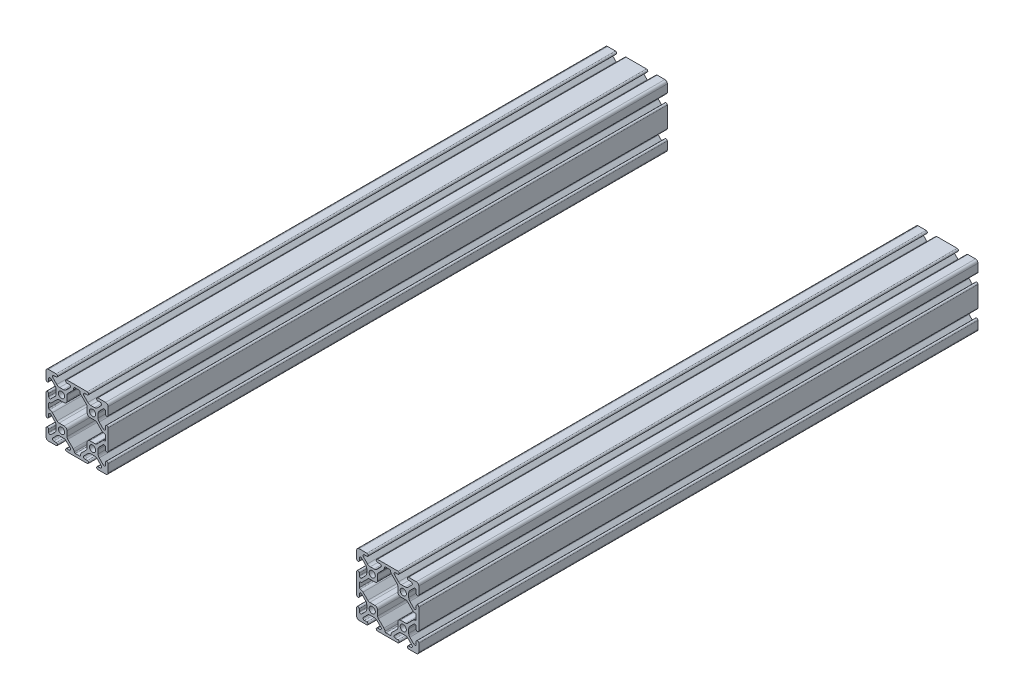
from build123d import *

# Parameters (mm, degrees)
SKETCH1_R                                = 2.5
F_25_SERIES_EXTRUSIONS_25_5050_1_DEPTH   = 450
SKETCH1_ON_SEGMENT_2_R                   = 2.5
F_25_SERIES_EXTRUSIONS_25_5050_1_2_DEPTH = 450


with BuildPart() as part:
    # Sketch1 → 25 series extrusions 25-5050(1) (new body)
    with BuildSketch(Plane(origin=(-125, 0, 0), x_dir=(0, 1, 0), z_dir=(0, 0, 1))):
        with BuildLine():
            Line((16.815, -25), (23, -25))
            ThreePointArc((23, -25), (24.414213562, -24.414213562), (25, -23))
            Line((25, -23), (25, -16.815))
            ThreePointArc((25, -16.815), (23.935, -15.75), (22.87, -16.815))
            Line((22.87, -16.815), (22.87, -18.772801987))
            ThreePointArc((22.87, -18.772801987), (22.208114403, -19.763383786), (21.039643501, -19.530960473))
            Line((21.039643501, -19.530960473), (17.811043881, -16.302360852))
            ThreePointArc((17.811043881, -16.302360852), (17.122790395, -15.27231672), (16.881107911, -14.057296822))
            Line((16.881107911, -14.057296822), (16.881107911, -10.942703178))
            ThreePointArc((16.881107911, -10.942703178), (17.122790395, -9.72768328), (17.811043881, -8.697639148))
            Line((17.811043881, -8.697639148), (21.039643501, -5.469039527))
            ThreePointArc((21.039643501, -5.469039527), (22.208114403, -5.236616214), (22.87, -6.227198013))
            Line((22.87, -6.227198013), (22.87, -8.185))
            ThreePointArc((22.87, -8.185), (23.935, -9.25), (25, -8.185))
            Line((25, -8.185), (25, 8.185))
            ThreePointArc((25, 8.185), (23.935, 9.25), (22.87, 8.185))
            Line((22.87, 8.185), (22.87, 6.227198013))
            ThreePointArc((22.87, 6.227198013), (22.208114403, 5.236616214), (21.039643501, 5.469039527))
            Line((21.039643501, 5.469039527), (17.811043881, 8.697639148))
            ThreePointArc((17.811043881, 8.697639148), (17.122790395, 9.72768328), (16.881107911, 10.942703178))
            Line((16.881107911, 10.942703178), (16.881107911, 14.057296822))
            ThreePointArc((16.881107911, 14.057296822), (17.122790395, 15.27231672), (17.811043881, 16.302360852))
            Line((17.811043881, 16.302360852), (21.039643501, 19.530960473))
            ThreePointArc((21.039643501, 19.530960473), (22.208114403, 19.763383786), (22.87, 18.772801987))
            Line((22.87, 18.772801987), (22.87, 16.815))
            ThreePointArc((22.87, 16.815), (23.935, 15.75), (25, 16.815))
            Line((25, 16.815), (25, 23))
            ThreePointArc((25, 23), (24.414213562, 24.414213562), (23, 25))
            Line((23, 25), (16.815, 25))
            ThreePointArc((16.815, 25), (15.75, 23.935), (16.815, 22.87))
            Line((16.815, 22.87), (18.772801987, 22.87))
            ThreePointArc((18.772801987, 22.87), (19.763383786, 22.208114403), (19.530960473, 21.039643501))
            Line((19.530960473, 21.039643501), (16.302360852, 17.811043881))
            ThreePointArc((16.302360852, 17.811043881), (15.27231672, 17.122790395), (14.057296822, 16.881107911))
            Line((14.057296822, 16.881107911), (10.942703178, 16.881107911))
            ThreePointArc((10.942703178, 16.881107911), (9.72768328, 17.122790395), (8.697639148, 17.811043881))
            Line((8.697639148, 17.811043881), (5.469039527, 21.039643501))
            ThreePointArc((5.469039527, 21.039643501), (5.236616214, 22.208114403), (6.227198013, 22.87))
            Line((6.227198013, 22.87), (8.185, 22.87))
            ThreePointArc((8.185, 22.87), (9.25, 23.935), (8.185, 25))
            Line((8.185, 25), (-8.185, 25))
            ThreePointArc((-8.185, 25), (-9.25, 23.935), (-8.185, 22.87))
            Line((-8.185, 22.87), (-6.227198013, 22.87))
            ThreePointArc((-6.227198013, 22.87), (-5.236616214, 22.208114403), (-5.469039527, 21.039643501))
            Line((-5.469039527, 21.039643501), (-8.697639148, 17.811043881))
            ThreePointArc((-8.697639148, 17.811043881), (-9.72768328, 17.122790395), (-10.942703178, 16.881107911))
            Line((-10.942703178, 16.881107911), (-14.057296822, 16.881107911))
            ThreePointArc((-14.057296822, 16.881107911), (-15.27231672, 17.122790395), (-16.302360852, 17.811043881))
            Line((-16.302360852, 17.811043881), (-19.530960473, 21.039643501))
            ThreePointArc((-19.530960473, 21.039643501), (-19.763383786, 22.208114403), (-18.772801987, 22.87))
            Line((-18.772801987, 22.87), (-16.815, 22.87))
            ThreePointArc((-16.815, 22.87), (-15.75, 23.935), (-16.815, 25))
            Line((-16.815, 25), (-23, 25))
            ThreePointArc((-23, 25), (-24.414213562, 24.414213562), (-25, 23))
            Line((-25, 23), (-25, 16.815))
            ThreePointArc((-25, 16.815), (-23.935, 15.75), (-22.87, 16.815))
            Line((-22.87, 16.815), (-22.87, 18.772801987))
            ThreePointArc((-22.87, 18.772801987), (-22.208114403, 19.763383786), (-21.039643501, 19.530960473))
            Line((-21.039643501, 19.530960473), (-17.811043881, 16.302360852))
            ThreePointArc((-17.811043881, 16.302360852), (-17.122790395, 15.27231672), (-16.881107911, 14.057296822))
            Line((-16.881107911, 14.057296822), (-16.881107911, 10.942703178))
            ThreePointArc((-16.881107911, 10.942703178), (-17.122790395, 9.72768328), (-17.811043881, 8.697639148))
            Line((-17.811043881, 8.697639148), (-21.039643501, 5.469039527))
            ThreePointArc((-21.039643501, 5.469039527), (-22.208114403, 5.236616214), (-22.87, 6.227198013))
            Line((-22.87, 6.227198013), (-22.87, 8.185))
            ThreePointArc((-22.87, 8.185), (-23.935, 9.25), (-25, 8.185))
            Line((-25, 8.185), (-25, -8.185))
            ThreePointArc((-25, -8.185), (-23.935, -9.25), (-22.87, -8.185))
            Line((-22.87, -8.185), (-22.87, -6.227198013))
            ThreePointArc((-22.87, -6.227198013), (-22.208114403, -5.236616214), (-21.039643501, -5.469039527))
            Line((-21.039643501, -5.469039527), (-17.811043881, -8.697639148))
            ThreePointArc((-17.811043881, -8.697639148), (-17.122790395, -9.72768328), (-16.881107911, -10.942703178))
            Line((-16.881107911, -10.942703178), (-16.881107911, -14.057296822))
            ThreePointArc((-16.881107911, -14.057296822), (-17.122790395, -15.27231672), (-17.811043881, -16.302360852))
            Line((-17.811043881, -16.302360852), (-21.039643501, -19.530960473))
            ThreePointArc((-21.039643501, -19.530960473), (-22.208114403, -19.763383786), (-22.87, -18.772801987))
            Line((-22.87, -18.772801987), (-22.87, -16.815))
            ThreePointArc((-22.87, -16.815), (-23.935, -15.75), (-25, -16.815))
            Line((-25, -16.815), (-25, -23))
            ThreePointArc((-25, -23), (-24.414213562, -24.414213562), (-23, -25))
            Line((-23, -25), (-16.815, -25))
            ThreePointArc((-16.815, -25), (-15.75, -23.935), (-16.815, -22.87))
            Line((-16.815, -22.87), (-18.772801987, -22.87))
            ThreePointArc((-18.772801987, -22.87), (-19.763383786, -22.208114403), (-19.530960473, -21.039643501))
            Line((-19.530960473, -21.039643501), (-16.302360852, -17.811043881))
            ThreePointArc((-16.302360852, -17.811043881), (-15.27231672, -17.122790395), (-14.057296822, -16.881107911))
            Line((-14.057296822, -16.881107911), (-10.942703178, -16.881107911))
            ThreePointArc((-10.942703178, -16.881107911), (-9.72768328, -17.122790395), (-8.697639148, -17.811043881))
            Line((-8.697639148, -17.811043881), (-5.469039527, -21.039643501))
            ThreePointArc((-5.469039527, -21.039643501), (-5.236616214, -22.208114403), (-6.227198013, -22.87))
            Line((-6.227198013, -22.87), (-8.185, -22.87))
            ThreePointArc((-8.185, -22.87), (-9.25, -23.935), (-8.185, -25))
            Line((-8.185, -25), (8.185, -25))
            ThreePointArc((8.185, -25), (9.25, -23.935), (8.185, -22.87))
            Line((8.185, -22.87), (6.227198013, -22.87))
            ThreePointArc((6.227198013, -22.87), (5.236616214, -22.208114403), (5.469039527, -21.039643501))
            Line((5.469039527, -21.039643501), (8.697639148, -17.811043881))
            ThreePointArc((8.697639148, -17.811043881), (9.72768328, -17.122790395), (10.942703178, -16.881107911))
            Line((10.942703178, -16.881107911), (14.057296822, -16.881107911))
            ThreePointArc((14.057296822, -16.881107911), (15.27231672, -17.122790395), (16.302360852, -17.811043881))
            Line((16.302360852, -17.811043881), (19.530960473, -21.039643501))
            ThreePointArc((19.530960473, -21.039643501), (19.763383786, -22.208114403), (18.772801987, -22.87))
            Line((18.772801987, -22.87), (16.815, -22.87))
            ThreePointArc((16.815, -22.87), (15.75, -23.935), (16.815, -25))
        make_face()
        with Locations((12.5, 12.5)):
            Circle(SKETCH1_R, mode=Mode.SUBTRACT)
        with Locations((-12.5, -12.5)):
            Circle(SKETCH1_R, mode=Mode.SUBTRACT)
        with Locations((12.5, -12.5)):
            Circle(SKETCH1_R, mode=Mode.SUBTRACT)
        with Locations((-12.5, 12.5)):
            Circle(SKETCH1_R, mode=Mode.SUBTRACT)
        with BuildLine():
            Line((1.940045032, -22.8664), (-1.460974251, -22.8664))
            ThreePointArc((-1.460974251, -22.8664), (-1.963491172, -22.677218248), (-2.216488324, -22.203609304))
            ThreePointArc((-2.216488324, -22.203609304), (-2.516658833, -21.213189093), (-3.119399596, -20.371917375))
            Line((-3.119399596, -20.371917375), (-7.471656654, -16.019660318))
            ThreePointArc((-7.471656654, -16.019660318), (-7.95068108, -15.302749601), (-8.118892089, -14.457095752))
            Line((-8.118892089, -14.457095752), (-8.118892089, -10.328692089))
            ThreePointArc((-8.118892089, -10.328692089), (-8.766127524, -8.766127524), (-10.328692089, -8.118892089))
            Line((-10.328692089, -8.118892089), (-14.457095752, -8.118892089))
            ThreePointArc((-14.457095752, -8.118892089), (-15.302749601, -7.95068108), (-16.019660318, -7.471656654))
            Line((-16.019660318, -7.471656654), (-19.85933597, -3.631981002))
            ThreePointArc((-19.85933597, -3.631981002), (-20.889380102, -2.943727516), (-22.1044, -2.702045032))
            ThreePointArc((-22.1044, -2.702045032), (-22.643215367, -2.478860399), (-22.8664, -1.940045032))
            Line((-22.8664, -1.940045032), (-22.8664, 1.460974251))
            ThreePointArc((-22.8664, 1.460974251), (-22.677218248, 1.963491172), (-22.203609304, 2.216488324))
            ThreePointArc((-22.203609304, 2.216488324), (-21.213189093, 2.516658833), (-20.371917375, 3.119399596))
            Line((-20.371917375, 3.119399596), (-16.019660318, 7.471656654))
            ThreePointArc((-16.019660318, 7.471656654), (-15.302749601, 7.95068108), (-14.457095752, 8.118892089))
            Line((-14.457095752, 8.118892089), (-10.328692089, 8.118892089))
            ThreePointArc((-10.328692089, 8.118892089), (-8.766127524, 8.766127524), (-8.118892089, 10.328692089))
            Line((-8.118892089, 10.328692089), (-8.118892089, 14.457095752))
            ThreePointArc((-8.118892089, 14.457095752), (-7.95068108, 15.302749601), (-7.471656654, 16.019660318))
            Line((-7.471656654, 16.019660318), (-3.631981002, 19.85933597))
            ThreePointArc((-3.631981002, 19.85933597), (-2.943727516, 20.889380102), (-2.702045032, 22.1044))
            ThreePointArc((-2.702045032, 22.1044), (-2.478860399, 22.643215367), (-1.940045032, 22.8664))
            Line((-1.940045032, 22.8664), (1.460974251, 22.8664))
            ThreePointArc((1.460974251, 22.8664), (1.963491172, 22.677218248), (2.216488324, 22.203609304))
            ThreePointArc((2.216488324, 22.203609304), (2.516658833, 21.213189093), (3.119399596, 20.371917375))
            Line((3.119399596, 20.371917375), (7.471656654, 16.019660318))
            ThreePointArc((7.471656654, 16.019660318), (7.95068108, 15.302749601), (8.118892089, 14.457095752))
            Line((8.118892089, 14.457095752), (8.118892089, 10.328692089))
            ThreePointArc((8.118892089, 10.328692089), (8.766127524, 8.766127524), (10.328692089, 8.118892089))
            Line((10.328692089, 8.118892089), (14.457095752, 8.118892089))
            ThreePointArc((14.457095752, 8.118892089), (15.302749601, 7.95068108), (16.019660318, 7.471656654))
            Line((16.019660318, 7.471656654), (19.85933597, 3.631981002))
            ThreePointArc((19.85933597, 3.631981002), (20.889380102, 2.943727516), (22.1044, 2.702045032))
            ThreePointArc((22.1044, 2.702045032), (22.643215367, 2.478860399), (22.8664, 1.940045032))
            Line((22.8664, 1.940045032), (22.8664, -1.460974251))
            ThreePointArc((22.8664, -1.460974251), (22.677218248, -1.963491172), (22.203609304, -2.216488324))
            ThreePointArc((22.203609304, -2.216488324), (21.213189093, -2.516658833), (20.371917375, -3.119399596))
            Line((20.371917375, -3.119399596), (16.019660318, -7.471656654))
            ThreePointArc((16.019660318, -7.471656654), (15.302749601, -7.95068108), (14.457095752, -8.118892089))
            Line((14.457095752, -8.118892089), (10.328692089, -8.118892089))
            ThreePointArc((10.328692089, -8.118892089), (8.766127524, -8.766127524), (8.118892089, -10.328692089))
            Line((8.118892089, -10.328692089), (8.118892089, -14.457095752))
            ThreePointArc((8.118892089, -14.457095752), (7.95068108, -15.302749601), (7.471656654, -16.019660318))
            Line((7.471656654, -16.019660318), (3.631981002, -19.85933597))
            ThreePointArc((3.631981002, -19.85933597), (2.943727516, -20.889380102), (2.702045032, -22.1044))
            ThreePointArc((2.702045032, -22.1044), (2.478860399, -22.643215367), (1.940045032, -22.8664))
        make_face(mode=Mode.SUBTRACT)
    extrude(amount=F_25_SERIES_EXTRUSIONS_25_5050_1_DEPTH)


with BuildPart() as body_2:
    # Sketch1 on segment 2 (carried to segment 2) → 25 series extrusions 25-5050_1 2 (new body)
    with BuildSketch(Plane(origin=(125, 0, 0), x_dir=(0, 1, 0), z_dir=(0, 0, 1))):
        with BuildLine():
            Line((16.815, -25), (23, -25))
            ThreePointArc((23, -25), (24.414213562, -24.414213562), (25, -23))
            Line((25, -23), (25, -16.815))
            ThreePointArc((25, -16.815), (23.935, -15.75), (22.87, -16.815))
            Line((22.87, -16.815), (22.87, -18.772801987))
            ThreePointArc((22.87, -18.772801987), (22.208114403, -19.763383786), (21.039643501, -19.530960473))
            Line((21.039643501, -19.530960473), (17.811043881, -16.302360852))
            ThreePointArc((17.811043881, -16.302360852), (17.122790395, -15.27231672), (16.881107911, -14.057296822))
            Line((16.881107911, -14.057296822), (16.881107911, -10.942703178))
            ThreePointArc((16.881107911, -10.942703178), (17.122790395, -9.72768328), (17.811043881, -8.697639148))
            Line((17.811043881, -8.697639148), (21.039643501, -5.469039527))
            ThreePointArc((21.039643501, -5.469039527), (22.208114403, -5.236616214), (22.87, -6.227198013))
            Line((22.87, -6.227198013), (22.87, -8.185))
            ThreePointArc((22.87, -8.185), (23.935, -9.25), (25, -8.185))
            Line((25, -8.185), (25, 8.185))
            ThreePointArc((25, 8.185), (23.935, 9.25), (22.87, 8.185))
            Line((22.87, 8.185), (22.87, 6.227198013))
            ThreePointArc((22.87, 6.227198013), (22.208114403, 5.236616214), (21.039643501, 5.469039527))
            Line((21.039643501, 5.469039527), (17.811043881, 8.697639148))
            ThreePointArc((17.811043881, 8.697639148), (17.122790395, 9.72768328), (16.881107911, 10.942703178))
            Line((16.881107911, 10.942703178), (16.881107911, 14.057296822))
            ThreePointArc((16.881107911, 14.057296822), (17.122790395, 15.27231672), (17.811043881, 16.302360852))
            Line((17.811043881, 16.302360852), (21.039643501, 19.530960473))
            ThreePointArc((21.039643501, 19.530960473), (22.208114403, 19.763383786), (22.87, 18.772801987))
            Line((22.87, 18.772801987), (22.87, 16.815))
            ThreePointArc((22.87, 16.815), (23.935, 15.75), (25, 16.815))
            Line((25, 16.815), (25, 23))
            ThreePointArc((25, 23), (24.414213562, 24.414213562), (23, 25))
            Line((23, 25), (16.815, 25))
            ThreePointArc((16.815, 25), (15.75, 23.935), (16.815, 22.87))
            Line((16.815, 22.87), (18.772801987, 22.87))
            ThreePointArc((18.772801987, 22.87), (19.763383786, 22.208114403), (19.530960473, 21.039643501))
            Line((19.530960473, 21.039643501), (16.302360852, 17.811043881))
            ThreePointArc((16.302360852, 17.811043881), (15.27231672, 17.122790395), (14.057296822, 16.881107911))
            Line((14.057296822, 16.881107911), (10.942703178, 16.881107911))
            ThreePointArc((10.942703178, 16.881107911), (9.72768328, 17.122790395), (8.697639148, 17.811043881))
            Line((8.697639148, 17.811043881), (5.469039527, 21.039643501))
            ThreePointArc((5.469039527, 21.039643501), (5.236616214, 22.208114403), (6.227198013, 22.87))
            Line((6.227198013, 22.87), (8.185, 22.87))
            ThreePointArc((8.185, 22.87), (9.25, 23.935), (8.185, 25))
            Line((8.185, 25), (-8.185, 25))
            ThreePointArc((-8.185, 25), (-9.25, 23.935), (-8.185, 22.87))
            Line((-8.185, 22.87), (-6.227198013, 22.87))
            ThreePointArc((-6.227198013, 22.87), (-5.236616214, 22.208114403), (-5.469039527, 21.039643501))
            Line((-5.469039527, 21.039643501), (-8.697639148, 17.811043881))
            ThreePointArc((-8.697639148, 17.811043881), (-9.72768328, 17.122790395), (-10.942703178, 16.881107911))
            Line((-10.942703178, 16.881107911), (-14.057296822, 16.881107911))
            ThreePointArc((-14.057296822, 16.881107911), (-15.27231672, 17.122790395), (-16.302360852, 17.811043881))
            Line((-16.302360852, 17.811043881), (-19.530960473, 21.039643501))
            ThreePointArc((-19.530960473, 21.039643501), (-19.763383786, 22.208114403), (-18.772801987, 22.87))
            Line((-18.772801987, 22.87), (-16.815, 22.87))
            ThreePointArc((-16.815, 22.87), (-15.75, 23.935), (-16.815, 25))
            Line((-16.815, 25), (-23, 25))
            ThreePointArc((-23, 25), (-24.414213562, 24.414213562), (-25, 23))
            Line((-25, 23), (-25, 16.815))
            ThreePointArc((-25, 16.815), (-23.935, 15.75), (-22.87, 16.815))
            Line((-22.87, 16.815), (-22.87, 18.772801987))
            ThreePointArc((-22.87, 18.772801987), (-22.208114403, 19.763383786), (-21.039643501, 19.530960473))
            Line((-21.039643501, 19.530960473), (-17.811043881, 16.302360852))
            ThreePointArc((-17.811043881, 16.302360852), (-17.122790395, 15.27231672), (-16.881107911, 14.057296822))
            Line((-16.881107911, 14.057296822), (-16.881107911, 10.942703178))
            ThreePointArc((-16.881107911, 10.942703178), (-17.122790395, 9.72768328), (-17.811043881, 8.697639148))
            Line((-17.811043881, 8.697639148), (-21.039643501, 5.469039527))
            ThreePointArc((-21.039643501, 5.469039527), (-22.208114403, 5.236616214), (-22.87, 6.227198013))
            Line((-22.87, 6.227198013), (-22.87, 8.185))
            ThreePointArc((-22.87, 8.185), (-23.935, 9.25), (-25, 8.185))
            Line((-25, 8.185), (-25, -8.185))
            ThreePointArc((-25, -8.185), (-23.935, -9.25), (-22.87, -8.185))
            Line((-22.87, -8.185), (-22.87, -6.227198013))
            ThreePointArc((-22.87, -6.227198013), (-22.208114403, -5.236616214), (-21.039643501, -5.469039527))
            Line((-21.039643501, -5.469039527), (-17.811043881, -8.697639148))
            ThreePointArc((-17.811043881, -8.697639148), (-17.122790395, -9.72768328), (-16.881107911, -10.942703178))
            Line((-16.881107911, -10.942703178), (-16.881107911, -14.057296822))
            ThreePointArc((-16.881107911, -14.057296822), (-17.122790395, -15.27231672), (-17.811043881, -16.302360852))
            Line((-17.811043881, -16.302360852), (-21.039643501, -19.530960473))
            ThreePointArc((-21.039643501, -19.530960473), (-22.208114403, -19.763383786), (-22.87, -18.772801987))
            Line((-22.87, -18.772801987), (-22.87, -16.815))
            ThreePointArc((-22.87, -16.815), (-23.935, -15.75), (-25, -16.815))
            Line((-25, -16.815), (-25, -23))
            ThreePointArc((-25, -23), (-24.414213562, -24.414213562), (-23, -25))
            Line((-23, -25), (-16.815, -25))
            ThreePointArc((-16.815, -25), (-15.75, -23.935), (-16.815, -22.87))
            Line((-16.815, -22.87), (-18.772801987, -22.87))
            ThreePointArc((-18.772801987, -22.87), (-19.763383786, -22.208114403), (-19.530960473, -21.039643501))
            Line((-19.530960473, -21.039643501), (-16.302360852, -17.811043881))
            ThreePointArc((-16.302360852, -17.811043881), (-15.27231672, -17.122790395), (-14.057296822, -16.881107911))
            Line((-14.057296822, -16.881107911), (-10.942703178, -16.881107911))
            ThreePointArc((-10.942703178, -16.881107911), (-9.72768328, -17.122790395), (-8.697639148, -17.811043881))
            Line((-8.697639148, -17.811043881), (-5.469039527, -21.039643501))
            ThreePointArc((-5.469039527, -21.039643501), (-5.236616214, -22.208114403), (-6.227198013, -22.87))
            Line((-6.227198013, -22.87), (-8.185, -22.87))
            ThreePointArc((-8.185, -22.87), (-9.25, -23.935), (-8.185, -25))
            Line((-8.185, -25), (8.185, -25))
            ThreePointArc((8.185, -25), (9.25, -23.935), (8.185, -22.87))
            Line((8.185, -22.87), (6.227198013, -22.87))
            ThreePointArc((6.227198013, -22.87), (5.236616214, -22.208114403), (5.469039527, -21.039643501))
            Line((5.469039527, -21.039643501), (8.697639148, -17.811043881))
            ThreePointArc((8.697639148, -17.811043881), (9.72768328, -17.122790395), (10.942703178, -16.881107911))
            Line((10.942703178, -16.881107911), (14.057296822, -16.881107911))
            ThreePointArc((14.057296822, -16.881107911), (15.27231672, -17.122790395), (16.302360852, -17.811043881))
            Line((16.302360852, -17.811043881), (19.530960473, -21.039643501))
            ThreePointArc((19.530960473, -21.039643501), (19.763383786, -22.208114403), (18.772801987, -22.87))
            Line((18.772801987, -22.87), (16.815, -22.87))
            ThreePointArc((16.815, -22.87), (15.75, -23.935), (16.815, -25))
        make_face()
        with Locations((12.5, 12.5)):
            Circle(SKETCH1_ON_SEGMENT_2_R, mode=Mode.SUBTRACT)
        with Locations((-12.5, -12.5)):
            Circle(SKETCH1_ON_SEGMENT_2_R, mode=Mode.SUBTRACT)
        with Locations((12.5, -12.5)):
            Circle(SKETCH1_ON_SEGMENT_2_R, mode=Mode.SUBTRACT)
        with Locations((-12.5, 12.5)):
            Circle(SKETCH1_ON_SEGMENT_2_R, mode=Mode.SUBTRACT)
        with BuildLine():
            Line((1.940045032, -22.8664), (-1.460974251, -22.8664))
            ThreePointArc((-1.460974251, -22.8664), (-1.963491172, -22.677218248), (-2.216488324, -22.203609304))
            ThreePointArc((-2.216488324, -22.203609304), (-2.516658833, -21.213189093), (-3.119399596, -20.371917375))
            Line((-3.119399596, -20.371917375), (-7.471656654, -16.019660318))
            ThreePointArc((-7.471656654, -16.019660318), (-7.95068108, -15.302749601), (-8.118892089, -14.457095752))
            Line((-8.118892089, -14.457095752), (-8.118892089, -10.328692089))
            ThreePointArc((-8.118892089, -10.328692089), (-8.766127524, -8.766127524), (-10.328692089, -8.118892089))
            Line((-10.328692089, -8.118892089), (-14.457095752, -8.118892089))
            ThreePointArc((-14.457095752, -8.118892089), (-15.302749601, -7.95068108), (-16.019660318, -7.471656654))
            Line((-16.019660318, -7.471656654), (-19.85933597, -3.631981002))
            ThreePointArc((-19.85933597, -3.631981002), (-20.889380102, -2.943727516), (-22.1044, -2.702045032))
            ThreePointArc((-22.1044, -2.702045032), (-22.643215367, -2.478860399), (-22.8664, -1.940045032))
            Line((-22.8664, -1.940045032), (-22.8664, 1.460974251))
            ThreePointArc((-22.8664, 1.460974251), (-22.677218248, 1.963491172), (-22.203609304, 2.216488324))
            ThreePointArc((-22.203609304, 2.216488324), (-21.213189093, 2.516658833), (-20.371917375, 3.119399596))
            Line((-20.371917375, 3.119399596), (-16.019660318, 7.471656654))
            ThreePointArc((-16.019660318, 7.471656654), (-15.302749601, 7.95068108), (-14.457095752, 8.118892089))
            Line((-14.457095752, 8.118892089), (-10.328692089, 8.118892089))
            ThreePointArc((-10.328692089, 8.118892089), (-8.766127524, 8.766127524), (-8.118892089, 10.328692089))
            Line((-8.118892089, 10.328692089), (-8.118892089, 14.457095752))
            ThreePointArc((-8.118892089, 14.457095752), (-7.95068108, 15.302749601), (-7.471656654, 16.019660318))
            Line((-7.471656654, 16.019660318), (-3.631981002, 19.85933597))
            ThreePointArc((-3.631981002, 19.85933597), (-2.943727516, 20.889380102), (-2.702045032, 22.1044))
            ThreePointArc((-2.702045032, 22.1044), (-2.478860399, 22.643215367), (-1.940045032, 22.8664))
            Line((-1.940045032, 22.8664), (1.460974251, 22.8664))
            ThreePointArc((1.460974251, 22.8664), (1.963491172, 22.677218248), (2.216488324, 22.203609304))
            ThreePointArc((2.216488324, 22.203609304), (2.516658833, 21.213189093), (3.119399596, 20.371917375))
            Line((3.119399596, 20.371917375), (7.471656654, 16.019660318))
            ThreePointArc((7.471656654, 16.019660318), (7.95068108, 15.302749601), (8.118892089, 14.457095752))
            Line((8.118892089, 14.457095752), (8.118892089, 10.328692089))
            ThreePointArc((8.118892089, 10.328692089), (8.766127524, 8.766127524), (10.328692089, 8.118892089))
            Line((10.328692089, 8.118892089), (14.457095752, 8.118892089))
            ThreePointArc((14.457095752, 8.118892089), (15.302749601, 7.95068108), (16.019660318, 7.471656654))
            Line((16.019660318, 7.471656654), (19.85933597, 3.631981002))
            ThreePointArc((19.85933597, 3.631981002), (20.889380102, 2.943727516), (22.1044, 2.702045032))
            ThreePointArc((22.1044, 2.702045032), (22.643215367, 2.478860399), (22.8664, 1.940045032))
            Line((22.8664, 1.940045032), (22.8664, -1.460974251))
            ThreePointArc((22.8664, -1.460974251), (22.677218248, -1.963491172), (22.203609304, -2.216488324))
            ThreePointArc((22.203609304, -2.216488324), (21.213189093, -2.516658833), (20.371917375, -3.119399596))
            Line((20.371917375, -3.119399596), (16.019660318, -7.471656654))
            ThreePointArc((16.019660318, -7.471656654), (15.302749601, -7.95068108), (14.457095752, -8.118892089))
            Line((14.457095752, -8.118892089), (10.328692089, -8.118892089))
            ThreePointArc((10.328692089, -8.118892089), (8.766127524, -8.766127524), (8.118892089, -10.328692089))
            Line((8.118892089, -10.328692089), (8.118892089, -14.457095752))
            ThreePointArc((8.118892089, -14.457095752), (7.95068108, -15.302749601), (7.471656654, -16.019660318))
            Line((7.471656654, -16.019660318), (3.631981002, -19.85933597))
            ThreePointArc((3.631981002, -19.85933597), (2.943727516, -20.889380102), (2.702045032, -22.1044))
            ThreePointArc((2.702045032, -22.1044), (2.478860399, -22.643215367), (1.940045032, -22.8664))
        make_face(mode=Mode.SUBTRACT)
    extrude(amount=F_25_SERIES_EXTRUSIONS_25_5050_1_2_DEPTH)


solid = Compound([part.part, body_2.part])
